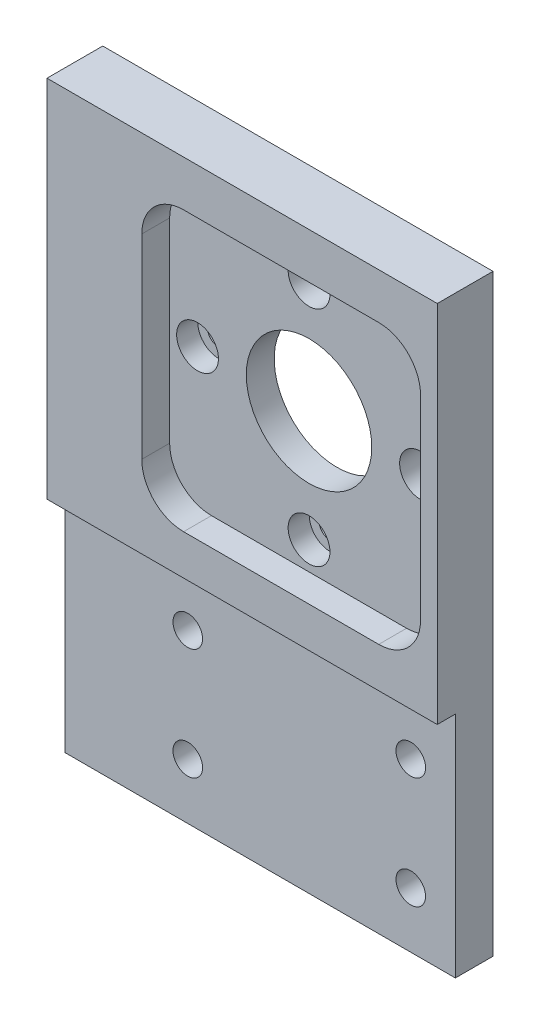
from build123d import *

# Parameters (mm, degrees)
SKETCH1_W                                       = 88.9
SKETCH1_H                                       = 135.128
BOSS_EXTRUDE1_DEPTH                             = 12.7
SKETCH2_R                                       = 14.2875
CUT_EXTRUDE1_DEPTH                              = 163.246961093
CBORE_FOR_10_SOCKET_HEAD_CAP_SCREW1_D           = 5.1054
CBORE_FOR_10_SOCKET_HEAD_CAP_SCREW1_CBORE_D     = 9.525
CBORE_FOR_10_SOCKET_HEAD_CAP_SCREW1_CBORE_DEPTH = 4.826
SKETCH5_R                                       = 3.3734375
CUT_EXTRUDE2_DEPTH                              = 163.246961093
SKETCH6_W                                       = 63.5
SKETCH6_H                                       = 63.5
CUT_EXTRUDE3_DEPTH                              = 6.35
FILLET1_R                                       = 9.525
SKETCH7_W                                       = 88.9
SKETCH7_H                                       = 52.07
CUT_EXTRUDE4_DEPTH                              = 4.1275
CBORE_FOR_10_SOCKET_HEAD_CAP_SCREW2_D           = 5.1054
CBORE_FOR_10_SOCKET_HEAD_CAP_SCREW2_DEPTH       = 22.86
CBORE_FOR_10_SOCKET_HEAD_CAP_SCREW2_CBORE_D     = 9.525
CBORE_FOR_10_SOCKET_HEAD_CAP_SCREW2_CBORE_DEPTH = 4.826
CBORE_FOR_10_SOCKET_HEAD_CAP_SCREW2_TIP         = 1.533816902


with BuildPart() as part:
    # Sketch1 → Boss-Extrude1 (new body)
    with BuildSketch(Plane.XY):
        with Locations((44.45, -67.564)):
            Rectangle(SKETCH1_W, SKETCH1_H)
    extrude(amount=BOSS_EXTRUDE1_DEPTH)

    # Sketch2 → Cut-Extrude1 (cut, through all)
    with BuildSketch(Plane.XY.offset(12.7)):
        with Locations((53.34, -42.164)):
            Circle(SKETCH2_R)
    extrude(amount=-CUT_EXTRUDE1_DEPTH, mode=Mode.SUBTRACT)

    # CBORE for #10 Socket Head Cap Screw1 (through all)
    with Locations(Plane.XY.offset(12.7)):
        with Locations((53.34, -16.764), (53.34, -67.564), (27.94, -42.164), (78.74, -42.164)):
            CounterBoreHole(CBORE_FOR_10_SOCKET_HEAD_CAP_SCREW1_D / 2, CBORE_FOR_10_SOCKET_HEAD_CAP_SCREW1_CBORE_D / 2, CBORE_FOR_10_SOCKET_HEAD_CAP_SCREW1_CBORE_DEPTH)

    # Sketch5 → Cut-Extrude2 (cut, through all)
    with BuildSketch(Plane.XY.offset(12.7)):
        with Locations((27.94, -122.428)):
            Circle(SKETCH5_R)
        with Locations((78.74, -122.428)):
            Circle(SKETCH5_R)
        with Locations((27.94, -97.028)):
            Circle(SKETCH5_R)
        with Locations((78.74, -97.028)):
            Circle(SKETCH5_R)
    extrude(amount=-CUT_EXTRUDE2_DEPTH, mode=Mode.SUBTRACT)

    # Sketch6 → Cut-Extrude3 (cut)
    with BuildSketch(Plane.XY.offset(12.7)):
        with Locations((53.34, -42.164)):
            Rectangle(SKETCH6_W, SKETCH6_H)
    extrude(amount=-CUT_EXTRUDE3_DEPTH, mode=Mode.SUBTRACT)

    # Fillet1
    fillet1_edges = [part.edges().sort_by_distance(p)[0] for p in [
        (85.09, -10.414, 9.525),
        (85.09, -73.914, 9.525),
        (21.59, -73.914, 9.525),
        (21.59, -10.414, 9.525),
    ]]
    fillet(fillet1_edges, radius=FILLET1_R)

    # Sketch7 → Cut-Extrude4 (cut)
    with BuildSketch(Plane.XY.offset(12.7)):
        with Locations((44.45, -109.093)):
            Rectangle(SKETCH7_W, SKETCH7_H)
    extrude(amount=-CUT_EXTRUDE4_DEPTH, mode=Mode.SUBTRACT)

    # CBORE for #10 Socket Head Cap Screw2
    with Locations(Plane.XY.offset(6.35)):
        with Locations((53.34, -16.764), (78.74, -42.164), (53.34, -67.564), (27.94, -42.164)):
            CounterBoreHole(CBORE_FOR_10_SOCKET_HEAD_CAP_SCREW2_D / 2, CBORE_FOR_10_SOCKET_HEAD_CAP_SCREW2_CBORE_D / 2, CBORE_FOR_10_SOCKET_HEAD_CAP_SCREW2_CBORE_DEPTH, depth=CBORE_FOR_10_SOCKET_HEAD_CAP_SCREW2_DEPTH)
            with Locations((0, 0, -(CBORE_FOR_10_SOCKET_HEAD_CAP_SCREW2_DEPTH + CBORE_FOR_10_SOCKET_HEAD_CAP_SCREW2_TIP / 2))):  # 118° drill point
                Cone(0, CBORE_FOR_10_SOCKET_HEAD_CAP_SCREW2_D / 2, CBORE_FOR_10_SOCKET_HEAD_CAP_SCREW2_TIP, mode=Mode.SUBTRACT)


solid = part.part
